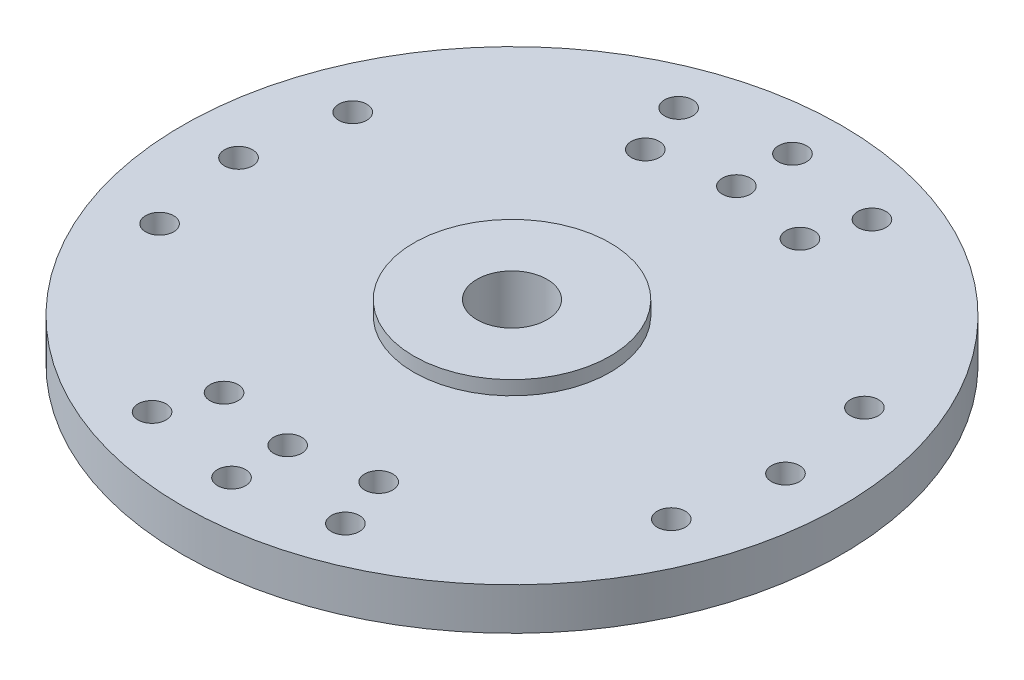
from build123d import *

# Parameters (mm, degrees)
SKETCH1_R               = 11.75
BOSS_EXTRUDE1_DEPTH     = 1.5
BOSS_EXTRUDE2_START     = 0.5
SKETCH2_R               = 3.5
BOSS_EXTRUDE2_DEPTH     = 4.3
CUT_EXTRUDE1_DEPTH      = 18.164352595
CUT_EXTRUDE1_DEPTH_BACK = 18.164352595
SKETCH3_R               = 1.25
SKETCH4_R               = 0.5
CUT_EXTRUDE2_DEPTH      = 18.045967265
SKETCH5_R               = 0.5
CUT_EXTRUDE3_DEPTH      = 17.77542846
CIRPATTERN1_COUNT       = 2
SKETCH6_R               = 2.375
CUT_EXTRUDE4_DEPTH      = 2.25


with BuildPart() as part:
    # Sketch1 → Boss-Extrude1 (new body)
    with BuildSketch(Plane(origin=(0, 0, 0), x_dir=(1, 0, 0), z_dir=(0, 1, 0))):
        Circle(SKETCH1_R)
    extrude(amount=BOSS_EXTRUDE1_DEPTH)

    # Sketch2 → Boss-Extrude2 (add)
    with BuildSketch(Plane(origin=(0, 1.5, 0), x_dir=(1, 0, 0), z_dir=(0, 1, 0)).offset(BOSS_EXTRUDE2_START)):
        Circle(SKETCH2_R)
    extrude(amount=-BOSS_EXTRUDE2_DEPTH)

    # Sketch3 → Cut-Extrude1 (cut, two sides: drawn at the far end of the back side and taken through both)
    with BuildSketch(Plane(origin=(0, 2, 0), x_dir=(1, 0, 0), z_dir=(0, 1, 0)).offset(-CUT_EXTRUDE1_DEPTH_BACK)):
        Circle(SKETCH3_R)
    extrude(amount=CUT_EXTRUDE1_DEPTH + CUT_EXTRUDE1_DEPTH_BACK, mode=Mode.SUBTRACT)

    # Sketch4 → Cut-Extrude2 (cut, through all)
    with BuildSketch(Plane(origin=(0, 1.5, 0), x_dir=(1, 0, 0), z_dir=(0, 1, 0))):
        with Locations((9.75, 0)):
            Circle(SKETCH4_R)
        with Locations((9.121794872, 3.443161094)):
            Circle(SKETCH4_R)
        with Locations((9.121794872, -3.443161094)):
            Circle(SKETCH4_R)
    cut_extrude2 = extrude(amount=-CUT_EXTRUDE2_DEPTH, mode=Mode.SUBTRACT)

    # Sketch5 → Cut-Extrude3 (cut, symmetric)
    with BuildSketch(Plane(origin=(0, 0, 0), x_dir=(1, 0, 0), z_dir=(0, 1, 0))):
        with Locations((0, 8)):
            Circle(SKETCH5_R)
        with Locations((0, 10)):
            Circle(SKETCH5_R)
        with Locations((3.445989517, 9.3875)):
            Circle(SKETCH5_R)
        with Locations((2.756791613, 7.51)):
            Circle(SKETCH5_R)
        with Locations((-2.756791613, 7.51)):
            Circle(SKETCH5_R)
        with Locations((-3.445989517, 9.3875)):
            Circle(SKETCH5_R)
    cut_extrude3 = extrude(amount=CUT_EXTRUDE3_DEPTH, both=True, mode=Mode.SUBTRACT)

    # CirPattern1: Cut-Extrude2, Cut-Extrude3 ×2 about axis
    cirpattern1_axis = Axis((0, 2.215, 0), (0, -1, 0))
    add([cut_extrude2.rotate(cirpattern1_axis, i * 360 / CIRPATTERN1_COUNT) for i in range(1, CIRPATTERN1_COUNT)], mode=Mode.SUBTRACT)
    add([cut_extrude3.rotate(cirpattern1_axis, i * 360 / CIRPATTERN1_COUNT) for i in range(1, CIRPATTERN1_COUNT)], mode=Mode.SUBTRACT)

    # Sketch6 → Cut-Extrude4 (cut)
    with BuildSketch(Plane.XZ.offset(2.3)):
        Circle(SKETCH6_R)
    extrude(amount=-CUT_EXTRUDE4_DEPTH, mode=Mode.SUBTRACT)


solid = part.part
